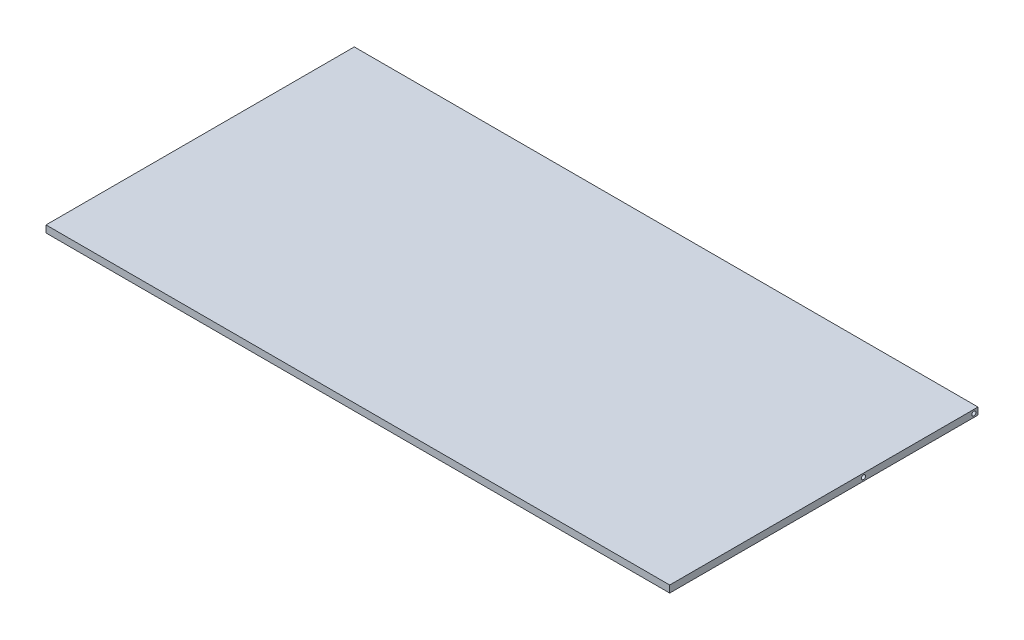
from build123d import *

# Parameters (mm, degrees)
SKETCH1_W           = 1130.470633397
SKETCH1_H           = 558.8
BOSS_EXTRUDE1_DEPTH = 12.7
SKETCH2_R           = 3.75
CUT_EXTRUDE1_DEPTH  = 10


with BuildPart() as part:
    # Sketch1 → Boss-Extrude1 (new body)
    with BuildSketch(Plane(origin=(0, 0, 0), x_dir=(1, 0, 0), z_dir=(0, 1, 0))):
        with Locations((565.235316699, 279.4)):
            Rectangle(SKETCH1_W, SKETCH1_H)
    extrude(amount=BOSS_EXTRUDE1_DEPTH)

    # Sketch2 → Cut-Extrude1 (cut)
    with BuildSketch(Plane(origin=(1130.470633397, 0, 0), x_dir=(0, 0, -1), z_dir=(1, 0, 0))):
        with Locations((551.3, 6.35)):
            Circle(SKETCH2_R)
        with Locations((351.3, 6.35)):
            Circle(SKETCH2_R)
    extrude(amount=-CUT_EXTRUDE1_DEPTH, mode=Mode.SUBTRACT)


solid = part.part
